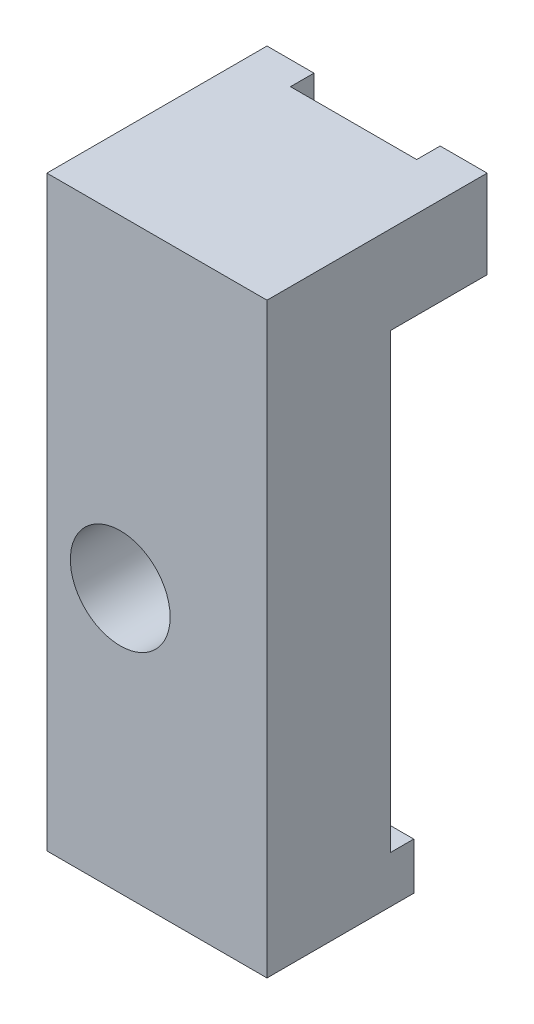
from build123d import *

# Parameters (mm, degrees)
SKETCH1_W           = 9.525
SKETCH1_H           = 25.4
BOSS_EXTRUDE1_DEPTH = 4.7625
CUT_EXTRUDE1_REACH  = 18.574
SKETCH2_W           = 3.175
SKETCH2_H           = 21.59
CUT_EXTRUDE2_REACH  = 18.574
SKETCH3_R           = 2.159
CUT_EXTRUDE3_REACH  = 28.278
SKETCH4_W           = 5.461
SKETCH4_H           = 1.016
SKETCH5_W           = 1.016
SKETCH5_H           = 19.558
CUT_EXTRUDE4_DEPTH  = 17.573986583


with BuildPart() as part:
    # Sketch1 → Boss-Extrude1 (new, symmetric)
    with BuildSketch(Plane.XY):
        Rectangle(SKETCH1_W, SKETCH1_H)
    extrude(amount=BOSS_EXTRUDE1_DEPTH, both=True)

    # Sketch2 → Cut-Extrude1 (cut, up to next)
    with BuildSketch(Plane(origin=(4.7625, 0, 0), x_dir=(0, 0, -1), z_dir=(1, 0, 0)), mode=Mode.PRIVATE) as cut_extrude1_sk1:
        with Locations((3.175, -1.905)):
            Rectangle(SKETCH2_W, SKETCH2_H)
    cut_extrude1_tool1 = extrude(cut_extrude1_sk1.sketch, amount=-CUT_EXTRUDE1_REACH, mode=Mode.PRIVATE) & part.part
    add(cut_extrude1_tool1.solids().sort_by_distance((4.7625, -1.905, -3.175))[0], mode=Mode.SUBTRACT)

    # Sketch3 → Cut-Extrude2 (cut, up to next)
    with BuildSketch(Plane.XY.offset(4.7625), mode=Mode.PRIVATE) as cut_extrude2_sk1:
        with Locations((-1.5875, -1.27)):
            Circle(SKETCH3_R)
    cut_extrude2_tool1 = extrude(cut_extrude2_sk1.sketch, amount=-CUT_EXTRUDE2_REACH, mode=Mode.PRIVATE) & part.part
    add(cut_extrude2_tool1.solids().sort_by_distance((-1.5875, -1.27, 4.7625))[0], mode=Mode.SUBTRACT)

    # Sketch4 → Cut-Extrude3 (cut, up to next)
    with BuildSketch(Plane(origin=(0, 12.7, 0), x_dir=(1, 0, 0), z_dir=(0, 1, 0)), mode=Mode.PRIVATE) as cut_extrude3_sk1:
        with Locations((0, 4.2545)):
            Rectangle(SKETCH4_W, SKETCH4_H)
    cut_extrude3_tool1 = extrude(cut_extrude3_sk1.sketch, amount=-CUT_EXTRUDE3_REACH, mode=Mode.PRIVATE) & part.part
    add(cut_extrude3_tool1.solids().sort_by_distance((0, 12.7, -4.2545))[0], mode=Mode.SUBTRACT)

    # Sketch5 → Cut-Extrude4 (cut, through all)
    with BuildSketch(Plane(origin=(4.7625, 0, 0), x_dir=(0, 0, -1), z_dir=(1, 0, 0))):
        with Locations((1.0795, -0.889)):
            Rectangle(SKETCH5_W, SKETCH5_H)
    extrude(amount=-CUT_EXTRUDE4_DEPTH, mode=Mode.SUBTRACT)


solid = part.part
